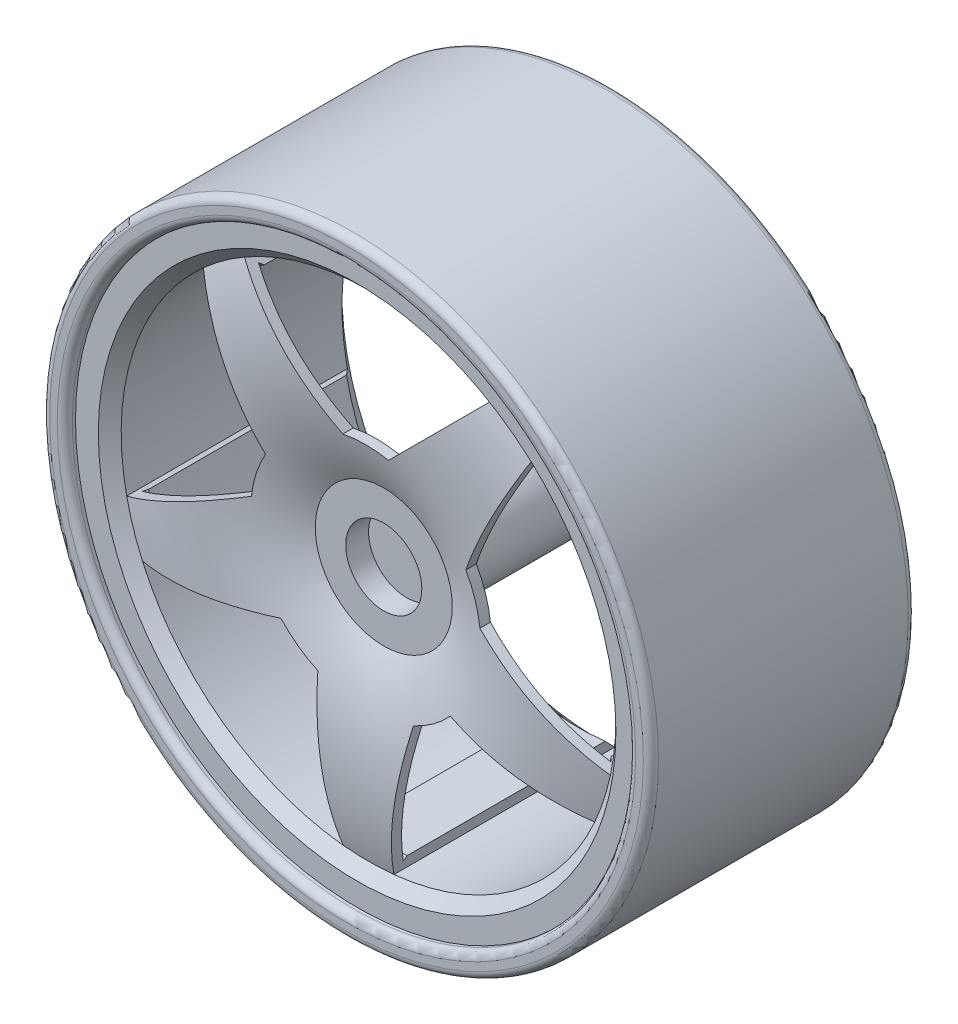
from build123d import *

# Parameters (mm, degrees)
CUT_EXTRUDE2_DEPTH      = 10
CUT_EXTRUDE2_DEPTH_BACK = 10
BOSS_EXTRUDE1_START     = -0.2
SKETCH6_R               = 2.5
SKETCH6_R_2             = 1.5
BOSS_EXTRUDE1_DEPTH     = 10


with BuildPart() as part:
    # Sketch1 → Revolve1 (revolve)
    with BuildSketch(Plane(origin=(0, 0, 0), x_dir=(0, 0, -1), z_dir=(1, 0, 0)), mode=Mode.PRIVATE) as revolve1_sk:
        Polygon((6.5, 15.5), (-6.5, 15.5), (-8, 17), (-8, 18.5), (-6.5, 18.5), (-5, 16.5), (5, 16.5), (6.5, 18.5), (8, 18.5), (8, 17), align=None)
    revolve(revolve1_sk.sketch.rotate(Axis((0, 0, 10.557897078), (0, 0, -1)), 90), axis=Axis((0, 0, 10.557897078), (0, 0, -1)))

    # Sketch3 → Revolve2 (revolve)
    with BuildSketch(Plane(origin=(0, 0, 0), x_dir=(0, 0, -1), z_dir=(1, 0, 0)), mode=Mode.PRIVATE) as revolve2_sk:
        with BuildLine():
            Line((-6.25, 4.5), (-6.25, 2.5))
            Line((-6.25, 2.5), (-4.75, 2.5))
            Line((-4.75, 2.5), (-4.75, 0))
            Line((-4.75, 0), (-4, 0))
            Line((-4, 0), (-4, 2.5))
            Line((-4, 2.5), (5.75, 2.5))
            Line((5.75, 2.5), (5.75, 3.25))
            Line((5.75, 3.25), (-5.5, 3.25))
            Line((-5.5, 3.25), (-5.5, 4.5))
            ThreePointArc((-5.5, 4.5), (-7.225700509, 9.988531242), (-6.719669914, 15.719669914))
            Line((-6.719669914, 15.719669914), (-7.25, 16.25))
            ThreePointArc((-7.25, 16.25), (-7.918610158, 10.275543816), (-6.25, 4.5))
        make_face()
    revolve(revolve2_sk.sketch.rotate(Axis((0, 0, 4.75), (0, 0, -1)), 90), axis=Axis((0, 0, 4.75), (0, 0, -1)))

    # Sketch4 → Cut-Extrude2 (cut, two sides: drawn at the far end of the back side and taken through both)
    with BuildSketch(Plane.XY.offset(-CUT_EXTRUDE2_DEPTH_BACK)):
        with BuildLine():
            Line((-1.5, 7.406883651), (-8.150991135, 14.057874786))
            ThreePointArc((-8.150991135, 14.057874786), (0, 16.25), (8.150991135, 14.057874786))
            Line((8.150991135, 14.057874786), (1.5, 7.406883651))
            ThreePointArc((1.5, 7.406883651), (0, 7.557243242), (-1.5, 7.406883651))
        make_face()
        with BuildLine():
            Line((6.58083947, 3.715437698), (10.851038639, 12.096175447))
            ThreePointArc((10.851038639, 12.096175447), (15.45466839, 5.021526159), (15.888628203, -3.40793102))
            Line((15.888628203, -3.40793102), (7.507890453, 0.862268149))
            ThreePointArc((7.507890453, 0.862268149), (7.187365431, 2.335316592), (6.58083947, 3.715437698))
        make_face()
        with BuildLine():
            Line((5.567182467, -5.110616871), (14.857301828, -6.582027226))
            ThreePointArc((14.857301828, -6.582027226), (9.55151035, -13.146526159), (1.668721129, -16.164091988))
            Line((1.668721129, -16.164091988), (3.140131484, -6.873972628))
            ThreePointArc((3.140131484, -6.873972628), (4.442036126, -6.113938214), (5.567182467, -5.110616871))
        make_face()
        with BuildLine():
            Line((-3.140131484, -6.873972628), (-1.668721129, -16.164091988))
            ThreePointArc((-1.668721129, -16.164091988), (-9.55151035, -13.146526159), (-14.857301828, -6.582027226))
            Line((-14.857301828, -6.582027226), (-5.567182467, -5.110616871))
            ThreePointArc((-5.567182467, -5.110616871), (-4.442036126, -6.113938214), (-3.140131484, -6.873972628))
        make_face()
        with BuildLine():
            Line((-7.507890453, 0.862268149), (-15.888628203, -3.40793102))
            ThreePointArc((-15.888628203, -3.40793102), (-15.45466839, 5.021526159), (-10.851038639, 12.096175447))
            Line((-10.851038639, 12.096175447), (-6.58083947, 3.715437698))
            ThreePointArc((-6.58083947, 3.715437698), (-7.187365431, 2.335316592), (-7.507890453, 0.862268149))
        make_face()
    extrude(amount=CUT_EXTRUDE2_DEPTH + CUT_EXTRUDE2_DEPTH_BACK, mode=Mode.SUBTRACT)

    # Sketch5 → Revolve3 (revolve)
    with BuildSketch(Plane(origin=(0, 0, 0), x_dir=(0, 0, -1), z_dir=(1, 0, 0)), mode=Mode.PRIVATE) as revolve3_sk:
        with BuildLine():
            Line((-8.2, 18.5), (-6.5, 18.5))
            Line((-6.5, 18.5), (-5, 16.5))
            Line((-5, 16.5), (5, 16.5))
            Line((5, 16.5), (6.5, 18.5))
            Line((6.5, 18.5), (8.2, 18.5))
            ThreePointArc((8.2, 18.5), (8.553553391, 18.646446609), (8.7, 19))
            Line((8.7, 19), (8.7, 19.5))
            ThreePointArc((8.7, 19.5), (8.553553391, 19.853553391), (8.2, 20))
            Line((8.2, 20), (-8.2, 20))
            ThreePointArc((-8.2, 20), (-8.553553391, 19.853553391), (-8.7, 19.5))
            Line((-8.7, 19.5), (-8.7, 19))
            ThreePointArc((-8.7, 19), (-8.553553391, 18.646446609), (-8.2, 18.5))
        make_face()
    revolve(revolve3_sk.sketch.rotate(Axis((0, 0, 17.280057329), (0, 0, -1)), 90), axis=Axis((0, 0, 17.280057329), (0, 0, -1)))

    # Sketch6 → Boss-Extrude1 (add)
    with BuildSketch(Plane(origin=(0, 0, -5.75), x_dir=(-1, 0, 0), z_dir=(0, 0, -1)).offset(BOSS_EXTRUDE1_START)):
        with Locations(Location((0, 0, 0), (0, 0, 180))):
            Circle(SKETCH6_R)
        Circle(SKETCH6_R_2, mode=Mode.SUBTRACT)
    extrude(amount=-BOSS_EXTRUDE1_DEPTH)


solid = part.part
